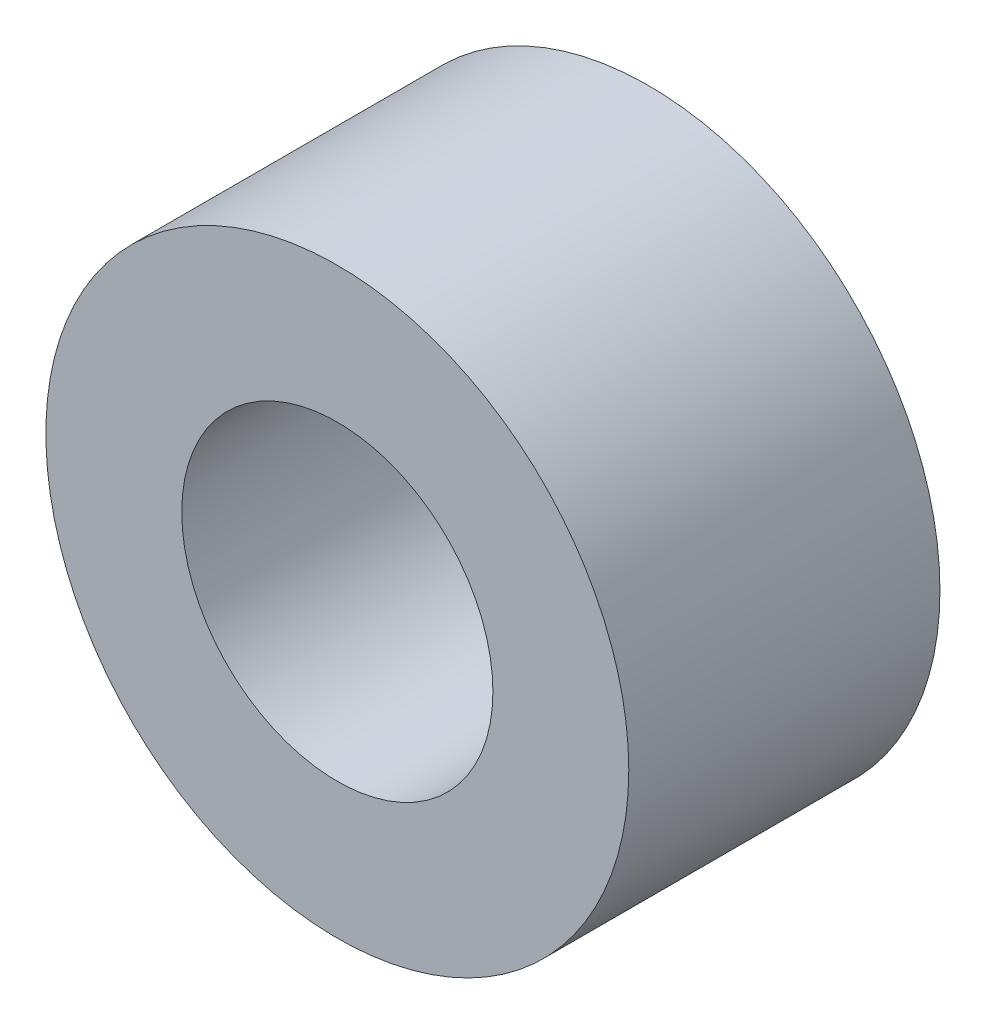
from build123d import *

# Parameters (mm, degrees)
SKETCH1_R           = 14.05
SKETCH1_R_2         = 7.5
BOSS_EXTRUDE1_DEPTH = 15


with BuildPart() as part:
    # Sketch1 → Boss-Extrude1 (new body)
    with BuildSketch(Plane(origin=(0, 0, 0), x_dir=(0, 1, 0), z_dir=(0, 0, 1))):
        with Locations(Location((0, 0, 0), (0, 0, 270))):
            Circle(SKETCH1_R)
        with Locations(Location((0, 0, 0), (0, 0, 270))):
            Circle(SKETCH1_R_2, mode=Mode.SUBTRACT)
    extrude(amount=BOSS_EXTRUDE1_DEPTH)


solid = part.part
